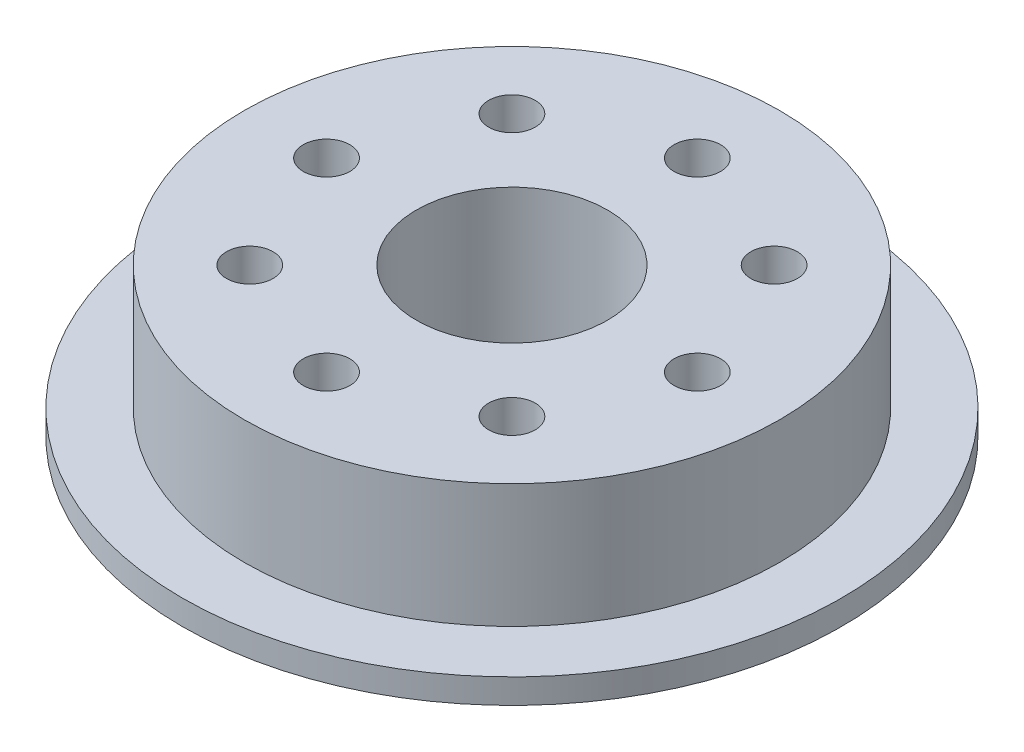
from build123d import *

# Parameters (mm, degrees)
SKETCH1_R           = 40
BOSS_EXTRUDE1_DEPTH = 3
SKETCH3_R           = 32.5
BOSS_EXTRUDE2_DEPTH = 15
SKETCH4_R           = 2.82527212
CUT_EXTRUDE1_DEPTH  = 60.363288319
SKETCH5_R           = 11.6
CUT_EXTRUDE2_DEPTH  = 60.363288319


with BuildPart() as part:
    # Sketch1 → Boss-Extrude1 (new body)
    with BuildSketch(Plane(origin=(0, 0, 0), x_dir=(1, 0, 0), z_dir=(0, 1, 0))):
        with Locations(Location((0, 0, 0), (0, 0, 270))):
            Circle(SKETCH1_R)
    extrude(amount=BOSS_EXTRUDE1_DEPTH)

    # Sketch3 → Boss-Extrude2 (add)
    with BuildSketch(Plane(origin=(0, 3, 0), x_dir=(1, 0, 0), z_dir=(0, 1, 0))):
        with Locations(Location((0, 0, 0), (0, 0, 270))):
            Circle(SKETCH3_R)
    extrude(amount=BOSS_EXTRUDE2_DEPTH)

    # Sketch4 → Cut-Extrude1 (cut, through all)
    with BuildSketch(Plane(origin=(0, 18, 0), x_dir=(1, 0, 0), z_dir=(0, 1, 0))):
        with Locations(Location((0, 22.5, 0), (0, 0, 270))):
            Circle(SKETCH4_R)
        with Locations(Location((15.909902577, 15.909902577, 0), (0, 0, 270))):
            Circle(SKETCH4_R)
        with Locations(Location((22.5, 0, 0), (0, 0, 270))):
            Circle(SKETCH4_R)
        with Locations(Location((15.909902577, -15.909902577, 0), (0, 0, 270))):
            Circle(SKETCH4_R)
        with Locations(Location((0, -22.5, 0), (0, 0, 270))):
            Circle(SKETCH4_R)
        with Locations(Location((-15.909902577, -15.909902577, 0), (0, 0, 270))):
            Circle(SKETCH4_R)
        with Locations(Location((-22.5, 0, 0), (0, 0, 270))):
            Circle(SKETCH4_R)
        with Locations(Location((-15.909902577, 15.909902577, 0), (0, 0, 270))):
            Circle(SKETCH4_R)
    extrude(amount=-CUT_EXTRUDE1_DEPTH, mode=Mode.SUBTRACT)

    # Sketch5 → Cut-Extrude2 (cut, through all)
    with BuildSketch(Plane.XZ):
        with Locations(Location((0, 0, 0), (0, 0, 270))):
            Circle(SKETCH5_R)
    extrude(amount=-CUT_EXTRUDE2_DEPTH, mode=Mode.SUBTRACT)


solid = part.part
